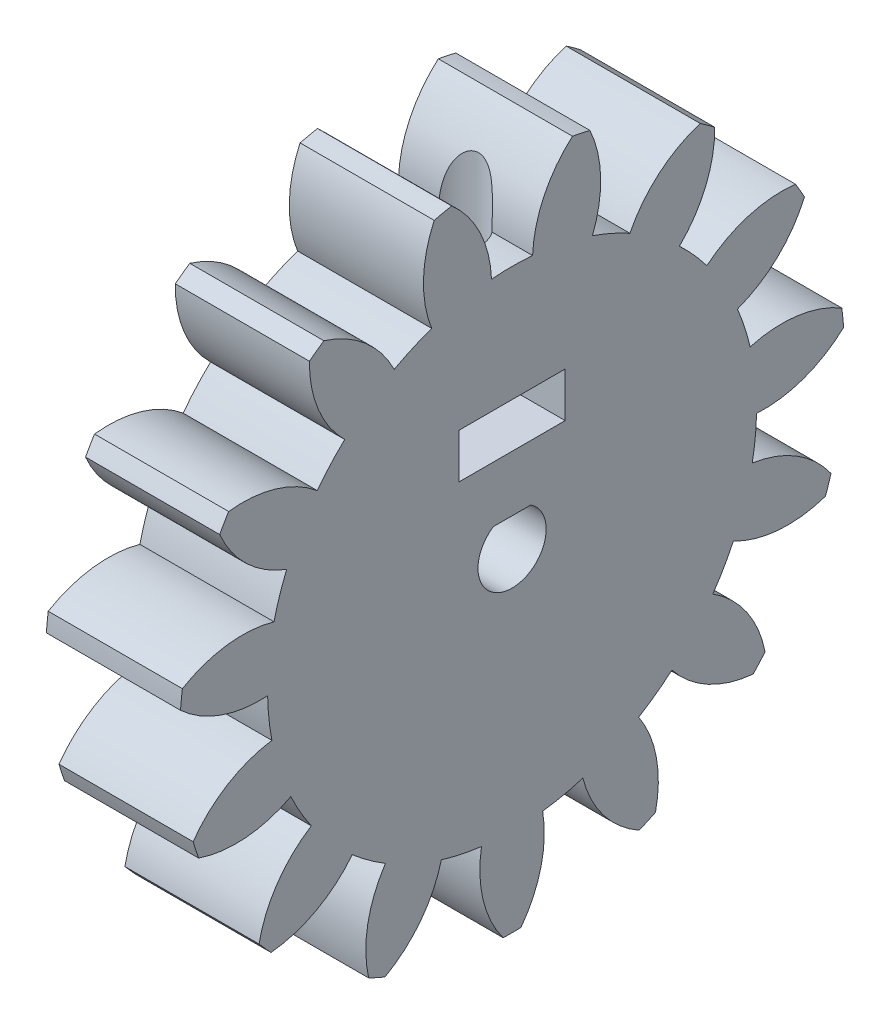
from build123d import *
from build123d.topology import SkipClean

# Parameters (mm, degrees)
BASPROSKE_W         = 10
BASPROSKE_H         = 29.75
TOOTHCUT_DEPTH      = 44.244941901
TEETHCUTS_COUNT     = 15
TEETHCUTS_ANGLE     = 336
BORSKE_R            = 3
BORE_DEPTH          = 50.0000508
SKETCH1_R           = 3.05
CUT_EXTRUDE1_DEPTH  = 10
SKETCH2_R           = 4.025367956
BOSS_EXTRUDE1_DEPTH = 4
SKETCH5_W           = 10.095897429
SKETCH5_H           = 0.5
BOSS_EXTRUDE5_DEPTH = 6
SKETCH6_W           = 1.25
SKETCH6_H           = 3.25
CUT_EXTRUDE2_DEPTH  = 3.25
CUT_EXTRUDE3_START  = 30
SKETCH7_R           = 1.5
CUT_EXTRUDE3_DEPTH  = 30
CUT_EXTRUDE4_START  = 30
SKETCH8_R           = 3
CUT_EXTRUDE4_DEPTH  = 14
BOSS_EXTRUDE7_DEPTH = 2
CUT_EXTRUDE5_START  = -2
SKETCH12_R          = 3.05
CUT_EXTRUDE5_DEPTH  = 2
SKETCH5_2_W         = 10.095897429
SKETCH5_2_H         = 0.5
BOSS_EXTRUDE8_DEPTH = 2
SKETCH15_R          = 1.75
CUT_EXTRUDE6_DEPTH  = 16
SKETCH18_W          = 9.5
SKETCH18_H          = 4
CUT_EXTRUDE7_DEPTH  = 44.689514195
SKETCH20_R          = 3
CUT_EXTRUDE9_DEPTH  = 4.45


with BuildPart() as part:
    # BasProSke → Base-Revolve (revolve)
    with BuildSketch(Plane(origin=(0, 0, 0), x_dir=(1, 0, 0), z_dir=(0, 1, 0)), mode=Mode.PRIVATE) as base_revolve_sk:
        with Locations((5, 14.875)):
            Rectangle(BASPROSKE_W, BASPROSKE_H)
    revolve(base_revolve_sk.sketch.rotate(Axis((-10, 0, 0), (1, 0, 0)), 180), axis=Axis((-10, 0, 0), (1, 0, 0)))

    # TooCutSke → ToothCut (cut, through all)
    with BuildSketch(Plane(origin=(0, 0, 0), x_dir=(0, 0, -1), z_dir=(1, 0, 0))):
        with BuildLine():
            ThreePointArc((1.837264636, 21.796704674), (0, 21.874), (-1.837264636, 21.796704674))
            ThreePointArc((-1.837264636, 21.796704674), (-2.861169083, 25.906231304), (-5.425297323, 29.27696354))
            ThreePointArc((-5.425297323, 29.27696354), (0, 29.7754), (5.425297323, 29.27696354))
            ThreePointArc((5.425297323, 29.27696354), (2.861169083, 25.906231304), (1.837264636, 21.796704674))
        make_face()
    toothcut = extrude(amount=TOOTHCUT_DEPTH, mode=Mode.SUBTRACT)

    # TeethCuts: ToothCut ×15 about axis
    teethcuts_axis = Axis((-10, 0, 0), (1, 0, 0))
    for i in range(1, TEETHCUTS_COUNT):
        add(toothcut.rotate(teethcuts_axis, i * TEETHCUTS_ANGLE / (TEETHCUTS_COUNT - 1)), mode=Mode.SUBTRACT)

    # BorSke → Bore (cut, symmetric)
    with BuildSketch(Plane(origin=(0, 0, 0), x_dir=(0, 0, -1), z_dir=(1, 0, 0))):
        with Locations(Location((0, 0, 0), (0, 0, 180))):
            Circle(BORSKE_R)
    extrude(amount=BORE_DEPTH, both=True, mode=Mode.SUBTRACT)

    # Sketch1 → Cut-Extrude1 (cut)
    with BuildSketch(Plane.ZY):
        Circle(SKETCH1_R)
    extrude(amount=-CUT_EXTRUDE1_DEPTH, mode=Mode.SUBTRACT)

    # Sketch2 → Boss-Extrude1 (add)
    with BuildSketch(Plane.ZY):
        Circle(SKETCH2_R)
    extrude(amount=-BOSS_EXTRUDE1_DEPTH)

    # Sketch5 → Boss-Extrude5 (add)
    with BuildSketch(Plane(origin=(10, 0, 0), x_dir=(0, 0, -1), z_dir=(1, 0, 0))):
        with Locations((0.095244316, 2.8)):
            Rectangle(SKETCH5_W, SKETCH5_H)
    extrude(amount=-BOSS_EXTRUDE5_DEPTH)

    # Sketch6 → Cut-Extrude2 (cut)
    with BuildSketch(Plane.ZY):
        Rectangle(SKETCH6_W, SKETCH6_H)
    extrude(amount=-CUT_EXTRUDE2_DEPTH, mode=Mode.SUBTRACT)

    # Sketch7 → Cut-Extrude3 (cut)
    with BuildSketch(Plane(origin=(0, 0, 0), x_dir=(1, 0, 0), z_dir=(0, 1, 0)).offset(CUT_EXTRUDE3_START)):
        with Locations(Location((6, 0, 0), (0, 0, 270))):
            Circle(SKETCH7_R)
    extrude(amount=-CUT_EXTRUDE3_DEPTH, mode=Mode.SUBTRACT)

    # Sketch8 → Cut-Extrude4 (cut)
    with BuildSketch(Plane(origin=(0, 0, 0), x_dir=(1, 0, 0), z_dir=(0, 1, 0)).offset(CUT_EXTRUDE4_START)):
        with Locations(Location((6, 0, 0), (0, 0, 270))):
            Circle(SKETCH8_R)
    extrude(amount=-CUT_EXTRUDE4_DEPTH, mode=Mode.SUBTRACT)

    # Sketch11 → Boss-Extrude7 (add)
    with SkipClean():  # the faces are left unmerged after this step: merging them gives an invalid solid
        with BuildSketch(Plane(origin=(10, 0, 0), x_dir=(0, 0, -1), z_dir=(1, 0, 0))):
            with BuildLine():
                ThreePointArc((-29.659924953, 2.313298902), (-26.048134954, 0.132131036), (-21.869346494, -0.451176136))
                ThreePointArc((-21.869346494, -0.451176136), (-21.754171939, -2.286455606), (-21.485253596, -4.105575952))
                ThreePointArc((-21.485253596, -4.105575952), (-25.451449122, -5.544955437), (-28.530822544, -8.429392917))
                ThreePointArc((-28.530822544, -8.429392917), (-28.29393136, -9.193255583), (-28.036593144, -9.950474605))
                ThreePointArc((-28.036593144, -9.950474605), (-23.849897902, -10.474023262), (-19.795132285, -9.307234489))
                ThreePointArc((-19.795132285, -9.307234489), (-18.943439682, -10.937), (-17.957867649, -12.489470186))
                ThreePointArc((-17.957867649, -12.489470186), (-20.995719175, -15.41760583), (-22.63566036, -19.305164596))
                ThreePointArc((-22.63566036, -19.305164596), (-22.108558558, -19.906635539), (-21.565479677, -20.493720656))
                ThreePointArc((-21.565479677, -20.493720656), (-17.527796832, -19.269123784), (-14.29815987, -16.553987445))
                ThreePointArc((-14.29815987, -16.553987445), (-12.857214609, -17.696437735), (-11.325403242, -18.713821561))
                ThreePointArc((-11.325403242, -18.713821561), (-12.909638643, -22.62441211), (-12.826586861, -26.842897934))
                ThreePointArc((-12.826586861, -26.842897934), (-12.100415132, -27.177977365), (-11.365498857, -27.493416225))
                ThreePointArc((-11.365498857, -27.493416225), (-8.174980456, -24.73241775), (-6.328905719, -20.938405584))
                ThreePointArc((-6.328905719, -20.938405584), (-4.547860325, -21.396000618), (-2.734673727, -21.702383178))
                ThreePointArc((-2.734673727, -21.702383178), (-2.591364309, -25.919252), (-0.799679967, -29.73925036))
                ThreePointArc((-0.799679967, -29.73925036), (0, -29.75), (0.799679967, -29.73925036))
                ThreePointArc((0.799679967, -29.73925036), (2.591364309, -25.919252), (2.734673727, -21.702383178))
                ThreePointArc((2.734673727, -21.702383178), (4.547860325, -21.396000618), (6.328905719, -20.938405584))
                ThreePointArc((6.328905719, -20.938405584), (8.174980456, -24.73241775), (11.365498857, -27.493416225))
                ThreePointArc((11.365498857, -27.493416225), (12.100415132, -27.177977365), (12.826586861, -26.842897934))
                ThreePointArc((12.826586861, -26.842897934), (12.909638643, -22.62441211), (11.325403242, -18.713821561))
                ThreePointArc((11.325403242, -18.713821561), (12.857214609, -17.696437735), (14.29815987, -16.553987445))
                ThreePointArc((14.29815987, -16.553987445), (17.527796832, -19.269123784), (21.565479677, -20.493720656))
                ThreePointArc((21.565479677, -20.493720656), (22.108558558, -19.906635539), (22.63566036, -19.305164596))
                ThreePointArc((22.63566036, -19.305164596), (20.995719175, -15.41760583), (17.957867649, -12.489470186))
                ThreePointArc((17.957867649, -12.489470186), (18.943439682, -10.937), (19.795132285, -9.307234489))
                ThreePointArc((19.795132285, -9.307234489), (23.849897902, -10.474023262), (28.036593144, -9.950474605))
                ThreePointArc((28.036593144, -9.950474605), (28.29393136, -9.193255583), (28.530822544, -8.429392917))
                ThreePointArc((28.530822544, -8.429392917), (25.451449122, -5.544955437), (21.485253596, -4.105575952))
                ThreePointArc((21.485253596, -4.105575952), (21.754171939, -2.286455606), (21.869346494, -0.451176136))
                ThreePointArc((21.869346494, -0.451176136), (26.048134954, 0.132131036), (29.659924953, 2.313298902))
                ThreePointArc((29.659924953, 2.313298902), (29.587026387, 3.109721782), (29.492746316, 3.903897376))
                ThreePointArc((29.492746316, 3.903897376), (25.506392296, 5.286468125), (21.29764401, 4.988209661))
                ThreePointArc((21.29764401, 4.988209661), (20.803410237, 6.759437735), (20.162152018, 8.48289467))
                ThreePointArc((20.162152018, 8.48289467), (23.742412833, 10.715438678), (26.154786285, 14.177082013))
                ThreePointArc((26.154786285, 14.177082013), (25.764255763, 14.875), (25.355106317, 15.562168347))
                ThreePointArc((25.355106317, 15.562168347), (21.151048524, 15.203813322), (17.427478291, 13.219488508))
                ThreePointArc((17.427478291, 13.219488508), (16.255549913, 14.636562884), (14.968738291, 15.950195923))
                ThreePointArc((14.968738291, 15.950195923), (17.331411841, 19.445949625), (18.127247459, 23.589518849))
                ThreePointArc((18.127247459, 23.589518849), (17.486611256, 24.068255583), (16.833338092, 24.529599032))
                ThreePointArc((16.833338092, 24.529599032), (13.138496311, 22.492281074), (10.543943252, 19.164997696))
                ThreePointArc((10.543943252, 19.164997696), (8.896957331, 19.98289334), (7.187093726, 20.659563397))
                ThreePointArc((7.187093726, 20.659563397), (7.92365229, 24.814079221), (6.965342867, 28.923113573))
                ThreePointArc((6.965342867, 28.923113573), (6.185372802, 29.099891122), (5.400932784, 29.255639201))
                ThreePointArc((5.400932784, 29.255639201), (2.854178726, 25.891629091), (1.837264636, 21.796704674))
                ThreePointArc((1.837264636, 21.796704674), (0, 21.874), (-1.837264636, 21.796704674))
                ThreePointArc((-1.837264636, 21.796704674), (-2.854178726, 25.891629091), (-5.400932784, 29.255639201))
                ThreePointArc((-5.400932784, 29.255639201), (-6.185372802, 29.099891122), (-6.965342867, 28.923113573))
                ThreePointArc((-6.965342867, 28.923113573), (-7.92365229, 24.814079221), (-7.187093726, 20.659563397))
                ThreePointArc((-7.187093726, 20.659563397), (-8.896957331, 19.98289334), (-10.543943252, 19.164997696))
                ThreePointArc((-10.543943252, 19.164997696), (-13.138496311, 22.492281074), (-16.833338092, 24.529599032))
                ThreePointArc((-16.833338092, 24.529599032), (-17.486611256, 24.068255583), (-18.127247459, 23.589518849))
                ThreePointArc((-18.127247459, 23.589518849), (-17.331411841, 19.445949625), (-14.968738291, 15.950195923))
                ThreePointArc((-14.968738291, 15.950195923), (-16.255549913, 14.636562884), (-17.427478291, 13.219488508))
                ThreePointArc((-17.427478291, 13.219488508), (-21.151048524, 15.203813322), (-25.355106317, 15.562168347))
                ThreePointArc((-25.355106317, 15.562168347), (-25.764255763, 14.875), (-26.154786285, 14.177082013))
                ThreePointArc((-26.154786285, 14.177082013), (-23.742412833, 10.715438678), (-20.162152018, 8.48289467))
                ThreePointArc((-20.162152018, 8.48289467), (-20.803410237, 6.759437735), (-21.29764401, 4.988209661))
                ThreePointArc((-21.29764401, 4.988209661), (-25.506392296, 5.286468125), (-29.492746316, 3.903897376))
                ThreePointArc((-29.492746316, 3.903897376), (-29.587026387, 3.109721782), (-29.659924953, 2.313298902))
            make_face()
        extrude(amount=BOSS_EXTRUDE7_DEPTH)

    # Sketch12 → Cut-Extrude5 (cut)
    with SkipClean():  # the faces are left unmerged after this step: merging them gives an invalid solid
        with BuildSketch(Plane(origin=(12, 0, 0), x_dir=(0, 0, -1), z_dir=(1, 0, 0)).offset(CUT_EXTRUDE5_START)):
            with Locations(Location((0, 0, 0), (0, 0, 123.273043413))):
                Circle(SKETCH12_R)
        extrude(amount=CUT_EXTRUDE5_DEPTH, mode=Mode.SUBTRACT)

    # Sketch5<2> → Boss-Extrude8 (add)
    with SkipClean():  # the faces are left unmerged after this step: merging them gives an invalid solid
        with BuildSketch(Plane(origin=(10, 0, 0), x_dir=(0, 0, -1), z_dir=(1, 0, 0))):
            with Locations((0.095244316, 2.8)):
                Rectangle(SKETCH5_2_W, SKETCH5_2_H)
        extrude(amount=BOSS_EXTRUDE8_DEPTH)

    # Sketch15 → Cut-Extrude6 (cut)
    with SkipClean():  # the faces are left unmerged after this step: merging them gives an invalid solid
        with BuildSketch(Plane(origin=(0, 16, 0), x_dir=(1, 0, 0), z_dir=(0, 1, 0))):
            with Locations(Location((6, 0, 0), (0, 0, 270))):
                Circle(SKETCH15_R)
        extrude(amount=-CUT_EXTRUDE6_DEPTH, mode=Mode.SUBTRACT)

    # Sketch18 → Cut-Extrude7 (cut, through all)
    with SkipClean():  # the faces are left unmerged after this step: merging them gives an invalid solid
        with BuildSketch(Plane(origin=(12, 0, 0), x_dir=(0, 0, -1), z_dir=(1, 0, 0))):
            with Locations((0, 9.55)):
                Rectangle(SKETCH18_W, SKETCH18_H)
        extrude(amount=-CUT_EXTRUDE7_DEPTH, mode=Mode.SUBTRACT)

    # Sketch20 → Cut-Extrude9 (cut)
    with SkipClean():  # the faces are left unmerged after this step: merging them gives an invalid solid
        with BuildSketch(Plane(origin=(0, 16, 0), x_dir=(1, 0, 0), z_dir=(0, 1, 0))):
            with Locations(Location((6, 0, 0), (0, 0, 322.235196827))):
                Circle(SKETCH20_R)
        extrude(amount=-CUT_EXTRUDE9_DEPTH, mode=Mode.SUBTRACT)


solid = part.part
